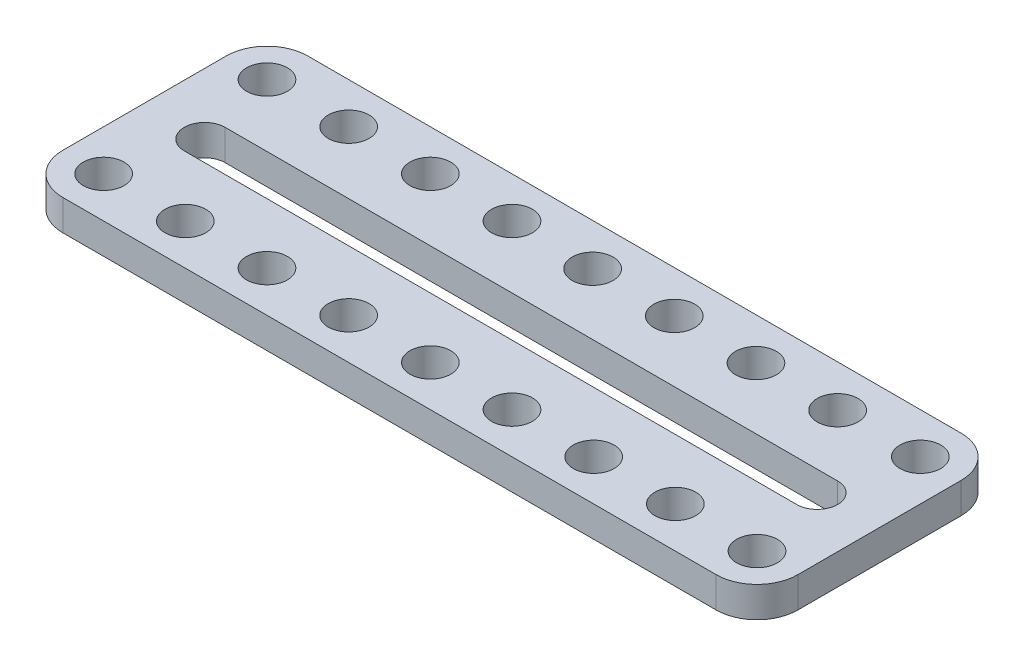
from build123d import *

# Parameters (mm, degrees)
BOSS_EXTRUDE1_DEPTH = 3
SKETCH12_R          = 2
CUT_EXTRUDE1_DEPTH  = 11


with BuildPart() as part:
    # Sketch11 → Boss-Extrude1 (new body)
    with BuildSketch(Plane(origin=(0, 0, 0), x_dir=(1, 0, 0), z_dir=(0, 1, 0))):
        with BuildLine():
            Line((-55.752395734, -4.879563459), (-55.752395734, -20.879563459))
            ThreePointArc((-55.752395734, -20.879563459), (-54.580822858, -23.707990583), (-51.752395734, -24.879563459))
            Line((-51.752395734, -24.879563459), (12.247604266, -24.879563459))
            ThreePointArc((12.247604266, -24.879563459), (15.076031391, -23.707990583), (16.247604266, -20.879563459))
            Line((16.247604266, -20.879563459), (16.247604266, -4.879563459))
            ThreePointArc((16.247604266, -4.879563459), (15.076031391, -2.051136334), (12.247604266, -0.879563459))
            Line((12.247604266, -0.879563459), (-51.752395734, -0.879563459))
            ThreePointArc((-51.752395734, -0.879563459), (-54.580822858, -2.051136334), (-55.752395734, -4.879563459))
        make_face()
    extrude(amount=BOSS_EXTRUDE1_DEPTH)

    # Sketch12 → Cut-Extrude1 (cut)
    with BuildSketch(Plane(origin=(0, 0, 0), x_dir=(1, 0, 0), z_dir=(0, 1, 0))):
        with Locations(Location((-51.752395734, -4.879563459, 0), (0, 0, 270))):
            Circle(SKETCH12_R)
        with Locations(Location((-43.752395734, -4.879563459, 0), (0, 0, 270))):
            Circle(SKETCH12_R)
        with Locations(Location((-35.752395734, -4.879563459, 0), (0, 0, 270))):
            Circle(SKETCH12_R)
        with Locations(Location((-27.752395734, -4.879563459, 0), (0, 0, 270))):
            Circle(SKETCH12_R)
        with Locations(Location((-19.75306076, -4.982713721, 0), (0, 0, 270))):
            Circle(SKETCH12_R)
        with Locations(Location((-11.75306076, -4.982713721, 0), (0, 0, 270))):
            Circle(SKETCH12_R)
        with Locations(Location((-3.75306076, -4.982713721, 0), (0, 0, 270))):
            Circle(SKETCH12_R)
        with Locations(Location((4.24693924, -4.982713721, 0), (0, 0, 270))):
            Circle(SKETCH12_R)
        with Locations(Location((12.247604266, -4.879563459, 0), (0, 0, 270))):
            Circle(SKETCH12_R)
        with Locations(Location((-51.752395734, -20.879563459, 0), (0, 0, 270))):
            Circle(SKETCH12_R)
        with Locations(Location((-43.752395734, -20.879563459, 0), (0, 0, 270))):
            Circle(SKETCH12_R)
        with Locations(Location((-35.752395734, -20.879563459, 0), (0, 0, 270))):
            Circle(SKETCH12_R)
        with Locations(Location((-27.752395734, -20.879563459, 0), (0, 0, 270))):
            Circle(SKETCH12_R)
        with Locations(Location((-19.752395734, -20.879563459, 0), (0, 0, 270))):
            Circle(SKETCH12_R)
        with Locations(Location((-11.752395734, -20.879563459, 0), (0, 0, 270))):
            Circle(SKETCH12_R)
        with Locations(Location((-3.752395734, -20.879563459, 0), (0, 0, 270))):
            Circle(SKETCH12_R)
        with Locations(Location((4.247604266, -20.879563459, 0), (0, 0, 270))):
            Circle(SKETCH12_R)
        with Locations(Location((12.247604266, -20.879563459, 0), (0, 0, 270))):
            Circle(SKETCH12_R)
        with BuildLine():
            Line((10.247604266, -14.982713721), (-49.752395734, -14.982713721))
            ThreePointArc((-49.752395734, -14.982713721), (-51.752395734, -12.982713721), (-49.752395734, -10.982713721))
            Line((-49.752395734, -10.982713721), (10.247604266, -10.982713721))
            ThreePointArc((10.247604266, -10.982713721), (12.247604266, -12.982713721), (10.247604266, -14.982713721))
        make_face()
    extrude(amount=CUT_EXTRUDE1_DEPTH, mode=Mode.SUBTRACT)


solid = part.part
